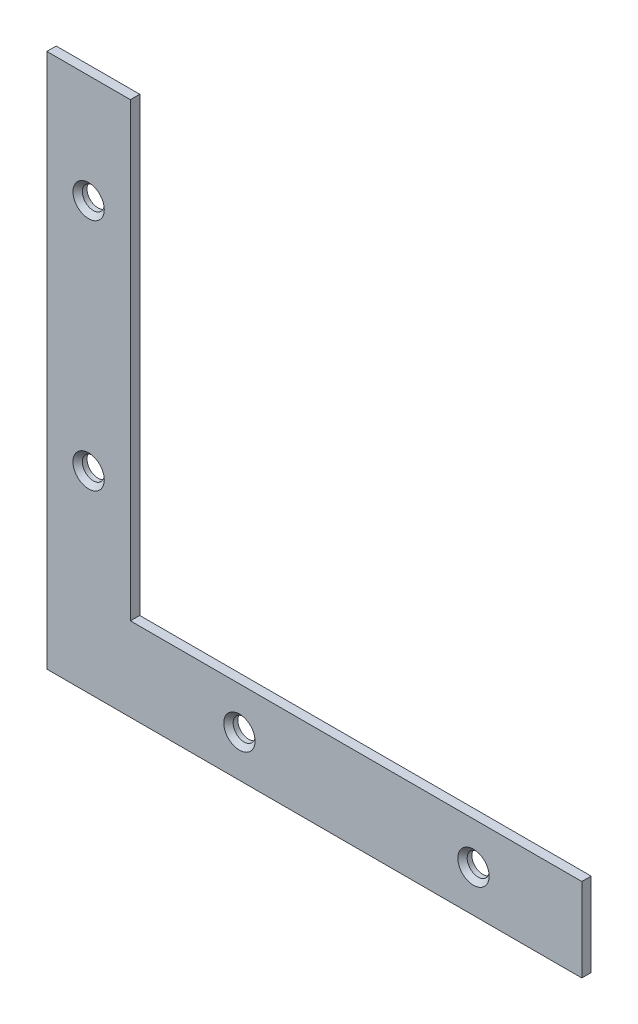
from build123d import *

# Parameters (mm, degrees)
EXTRUDE1_DEPTH           = 0.889
SKETCH2_R                = 2.0828
EXTRUDE2_DEPTH           = 144.686848114
CHAMFER1_SIZE            = 0.889
CHAMFER1_OF_MIRROR1_SIZE = 0.889


with BuildPart() as part:
    # Sketch1 → Extrude1 (new, symmetric)
    with BuildSketch(Plane.XY):
        Polygon((0, 101.6), (0, 0), (101.6, 0), (101.6, 15.875), (15.875, 15.875), (15.875, 101.6), align=None)
    extrude(amount=EXTRUDE1_DEPTH, both=True)

    # Sketch2 → Extrude2 (cut, symmetric)
    with BuildSketch(Plane.XY):
        with Locations((-14.224, 7.9375)):
            Circle(SKETCH2_R)
        with Locations((36.576, 7.9375)):
            Circle(SKETCH2_R)
        with Locations((81.026, 7.9375)):
            Circle(SKETCH2_R)
    extrude2 = extrude(amount=EXTRUDE2_DEPTH, both=True, mode=Mode.SUBTRACT)

    # Chamfer1
    chamfer1_edges = [part.edges().sort_by_distance(p)[0] for p in [
        (34.4932, 7.9375, 0.889),
        (78.9432, 7.9375, 0.889),
    ]]
    chamfer(chamfer1_edges, length=CHAMFER1_SIZE)

    # Mirror1: Extrude2 across plane
    add(extrude2.mirror(Plane(origin=(0, 0, 0), x_dir=(0, 0, 1), z_dir=(-0.7071067811865477, 0.7071067811865474, 0))), mode=Mode.SUBTRACT)

    # Chamfer1 of Mirror1
    chamfer1_of_mirror1_edges = [part.edges().sort_by_distance(p)[0] for p in [
        (7.9375, 34.4932, 0.889),
        (7.9375, 78.9432, 0.889),
    ]]
    chamfer(chamfer1_of_mirror1_edges, length=CHAMFER1_OF_MIRROR1_SIZE)


solid = part.part
